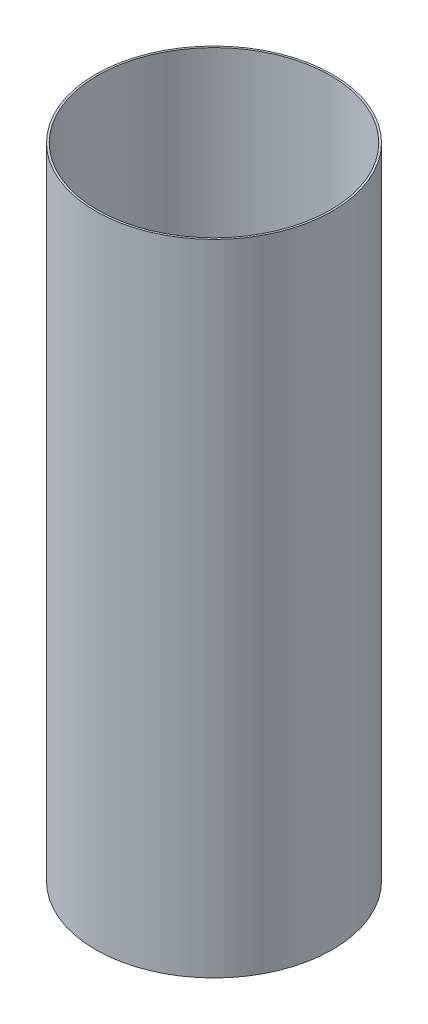
from build123d import *

# Parameters (mm, degrees)
SKETCH1_R           = 24.63
SKETCH1_R_2         = 24.23
BOSS_EXTRUDE1_DEPTH = 133


with BuildPart() as part:
    # Sketch1 → Boss-Extrude1 (new body)
    with BuildSketch(Plane(origin=(0, 0, 0), x_dir=(1, 0, 0), z_dir=(0, 1, 0))):
        with Locations(Location((0, 0, 0), (0, 0, 270))):
            Circle(SKETCH1_R)
        with Locations(Location((0, 0, 0), (0, 0, 270))):
            Circle(SKETCH1_R_2, mode=Mode.SUBTRACT)
    extrude(amount=BOSS_EXTRUDE1_DEPTH)


solid = part.part
